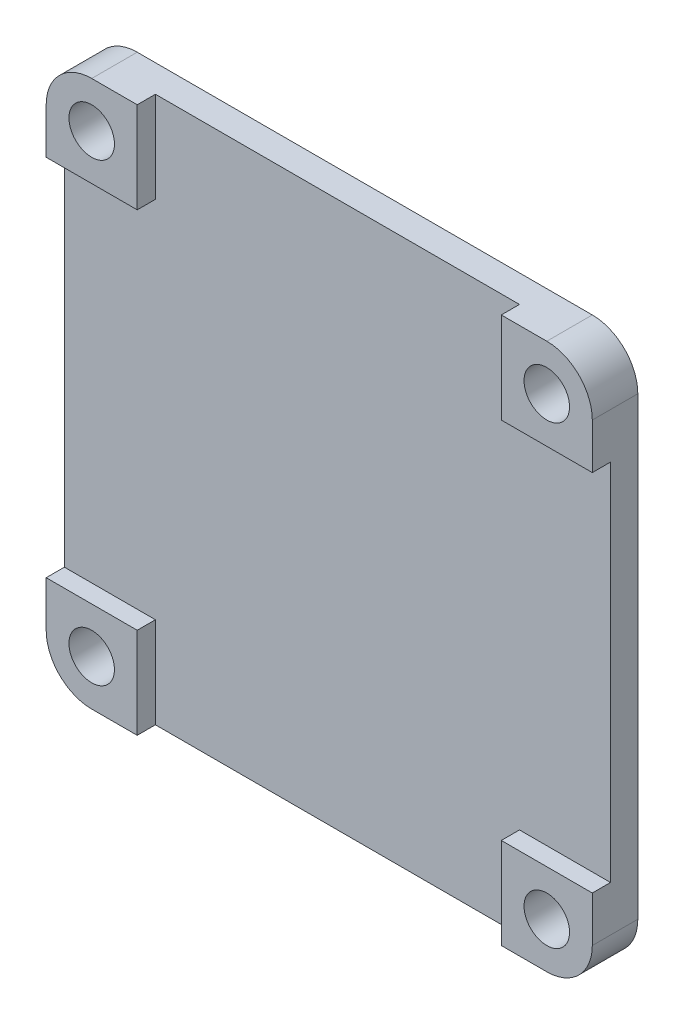
from build123d import *

# Parameters (mm, degrees)
SKETCH_1_R      = 2.5
EXTRUDE_1_DEPTH = 3
SKETCH_2_R      = 2.5
EXTRUDE_2_DEPTH = 2
SKETCH_3_W      = 1.5
SKETCH_3_H      = 20
EXTRUDE_4_DEPTH = 3
SKETCH_5_W      = 1.5
SKETCH_5_H      = 20
REVOLVE_2_ANGLE = 90
SKETCH_6_W      = 1.5
SKETCH_6_H      = 20
EXTRUDE_5_DEPTH = 5
SKETCH_8_W      = 1.5
SKETCH_8_H      = 20
REVOLVE_3_ANGLE = 90
SKETCH_9_W      = 1.5
SKETCH_9_H      = 20
EXTRUDE_6_DEPTH = 5


with BuildPart() as part:
    # 草图1 → 凸台-拉伸1 (new body)
    with BuildSketch(Plane.XY):
        with BuildLine():
            Line((-25, 30), (25, 30))
            ThreePointArc((25, 30), (28.535533906, 28.535533906), (30, 25))
            Line((30, 25), (30, -25))
            ThreePointArc((30, -25), (28.535533906, -28.535533906), (25, -30))
            Line((25, -30), (-25, -30))
            ThreePointArc((-25, -30), (-28.535533906, -28.535533906), (-30, -25))
            Line((-30, -25), (-30, 25))
            ThreePointArc((-30, 25), (-28.535533906, 28.535533906), (-25, 30))
        make_face()
        with Locations((-25, 25)):
            Circle(SKETCH_1_R, mode=Mode.SUBTRACT)
        with Locations(Location((25, 25, 0), (0, 0, 180))):
            Circle(SKETCH_1_R, mode=Mode.SUBTRACT)
        with Locations((25, -25)):
            Circle(SKETCH_1_R, mode=Mode.SUBTRACT)
        with Locations(Location((-25, -25, 0), (0, 0, 180))):
            Circle(SKETCH_1_R, mode=Mode.SUBTRACT)
    extrude(amount=EXTRUDE_1_DEPTH)

    # 草图2 → 凸台-拉伸2 (add)
    # profile 1 of 4: a face of its own
    with BuildSketch(Plane.XY.offset(3)):
        with BuildLine():
            Line((-30, 25), (-30, 20))
            Line((-30, 20), (-20, 20))
            Line((-20, 20), (-20, 30))
            Line((-20, 30), (-25, 30))
            ThreePointArc((-25, 30), (-28.535533906, 28.535533906), (-30, 25))
        make_face()
        with Locations((-25, 25)):
            Circle(SKETCH_2_R, mode=Mode.SUBTRACT)
    # profile 2 of 4: a face of its own
    with BuildSketch(Plane.XY.offset(3)):
        with BuildLine():
            Line((20, 30), (25, 30))
            ThreePointArc((25, 30), (28.535533906, 28.535533906), (30, 25))
            Line((30, 25), (30, 20))
            Line((30, 20), (20, 20))
            Line((20, 20), (20, 30))
        make_face()
        with Locations(Location((25, 25, 0), (0, 0, 180))):
            Circle(SKETCH_2_R, mode=Mode.SUBTRACT)
    # profile 3 of 4: a face of its own
    with BuildSketch(Plane.XY.offset(3)):
        with BuildLine():
            Line((30, -25), (30, -20))
            Line((30, -20), (20, -20))
            Line((20, -20), (20, -30))
            Line((20, -30), (25, -30))
            ThreePointArc((25, -30), (28.535533906, -28.535533906), (30, -25))
        make_face()
        with Locations((25, -25)):
            Circle(SKETCH_2_R, mode=Mode.SUBTRACT)
    # profile 4 of 4: a face of its own
    with BuildSketch(Plane.XY.offset(3)):
        with BuildLine():
            Line((-20, -30), (-25, -30))
            ThreePointArc((-25, -30), (-28.535533906, -28.535533906), (-30, -25))
            Line((-30, -25), (-30, -20))
            Line((-30, -20), (-20, -20))
            Line((-20, -20), (-20, -30))
        make_face()
        with Locations(Location((-25, -25, 0), (0, 0, 180))):
            Circle(SKETCH_2_R, mode=Mode.SUBTRACT)
    extrude(amount=EXTRUDE_2_DEPTH)

    # 草图3 → 凸台-拉伸4 (add)
    with BuildSketch(Plane(origin=(0, 0, 0), x_dir=(-1, 0, 0), z_dir=(0, 0, -1))):
        with Locations((-12.75, 0)):
            Rectangle(SKETCH_3_W, SKETCH_3_H)
        with Locations((12.75, 0)):
            Rectangle(SKETCH_3_W, SKETCH_3_H)
    extrude(amount=EXTRUDE_4_DEPTH)

    # 草图5 → 旋转2 (revolve)
    with BuildSketch(Plane(origin=(0, 0, -3), x_dir=(-1, 0, 0), z_dir=(0, 0, -1))):
        with Locations((-12.75, 0)):
            Rectangle(SKETCH_5_W, SKETCH_5_H)
    revolve(axis=Axis((12, 10, -3), (0, 1, 0)), revolution_arc=REVOLVE_2_ANGLE)

    # 草图6 → 凸台-拉伸5 (add)
    with BuildSketch(Plane.ZY.offset(-12)):
        with Locations((-3.75, 0)):
            Rectangle(SKETCH_6_W, SKETCH_6_H)
    extrude(amount=EXTRUDE_5_DEPTH)

    # 草图8 → 旋转3 (revolve)
    with BuildSketch(Plane(origin=(0, 0, -3), x_dir=(-1, 0, 0), z_dir=(0, 0, -1))):
        with Locations((12.75, 0)):
            Rectangle(SKETCH_8_W, SKETCH_8_H)
    revolve(axis=Axis((-12, 10, -3), (0, -1, 0)), revolution_arc=REVOLVE_3_ANGLE)

    # 草图9 → 凸台-拉伸6 (add)
    with BuildSketch(Plane(origin=(-12, 0, 0), x_dir=(0, 0, -1), z_dir=(1, 0, 0))):
        with Locations((3.75, 0)):
            Rectangle(SKETCH_9_W, SKETCH_9_H)
    extrude(amount=EXTRUDE_6_DEPTH)


solid = part.part
